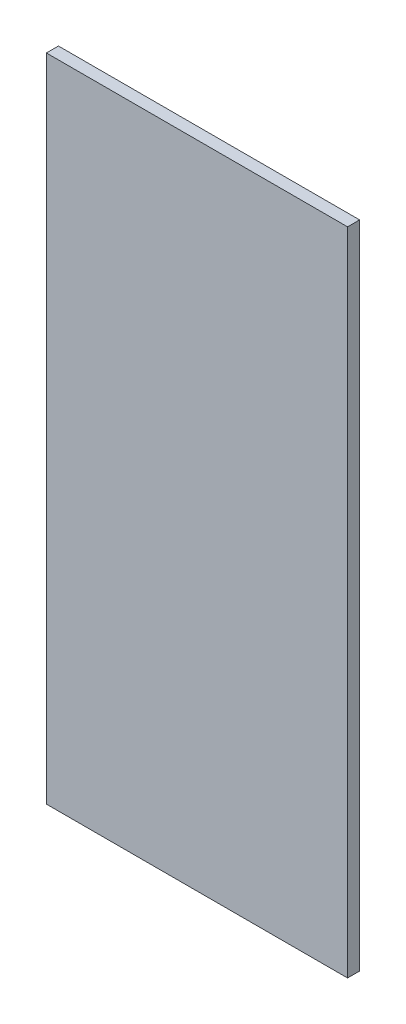
from build123d import *

# Parameters (mm, degrees)
SKETCH1_W           = 125
SKETCH1_H           = 270
BOSS_EXTRUDE1_DEPTH = 5


with BuildPart() as part:
    # Sketch1 → Boss-Extrude1 (new body)
    with BuildSketch(Plane.XY):
        with Locations((62.5, -135)):
            Rectangle(SKETCH1_W, SKETCH1_H)
    extrude(amount=BOSS_EXTRUDE1_DEPTH)


solid = part.part
